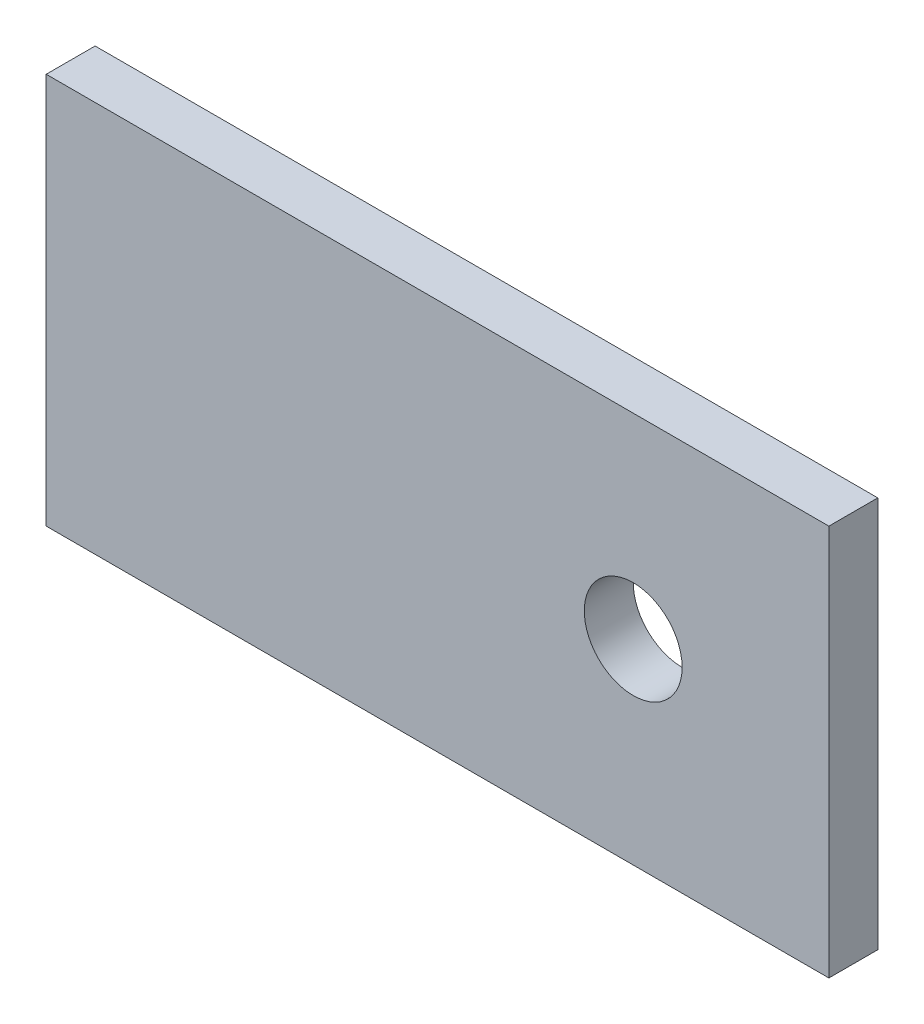
from build123d import *

# Parameters (mm, degrees)
SKETCH2_W           = 50.8
SKETCH2_H           = 25.4
SKETCH2_R           = 3.175
BOSS_EXTRUDE1_DEPTH = 3.175


with BuildPart() as part:
    # Sketch2 → Boss-Extrude1 (new body)
    with BuildSketch(Plane.XY):
        with Locations((-12.7, 0)):
            Rectangle(SKETCH2_W, SKETCH2_H)
        Circle(SKETCH2_R, mode=Mode.SUBTRACT)
    extrude(amount=BOSS_EXTRUDE1_DEPTH)


solid = part.part
